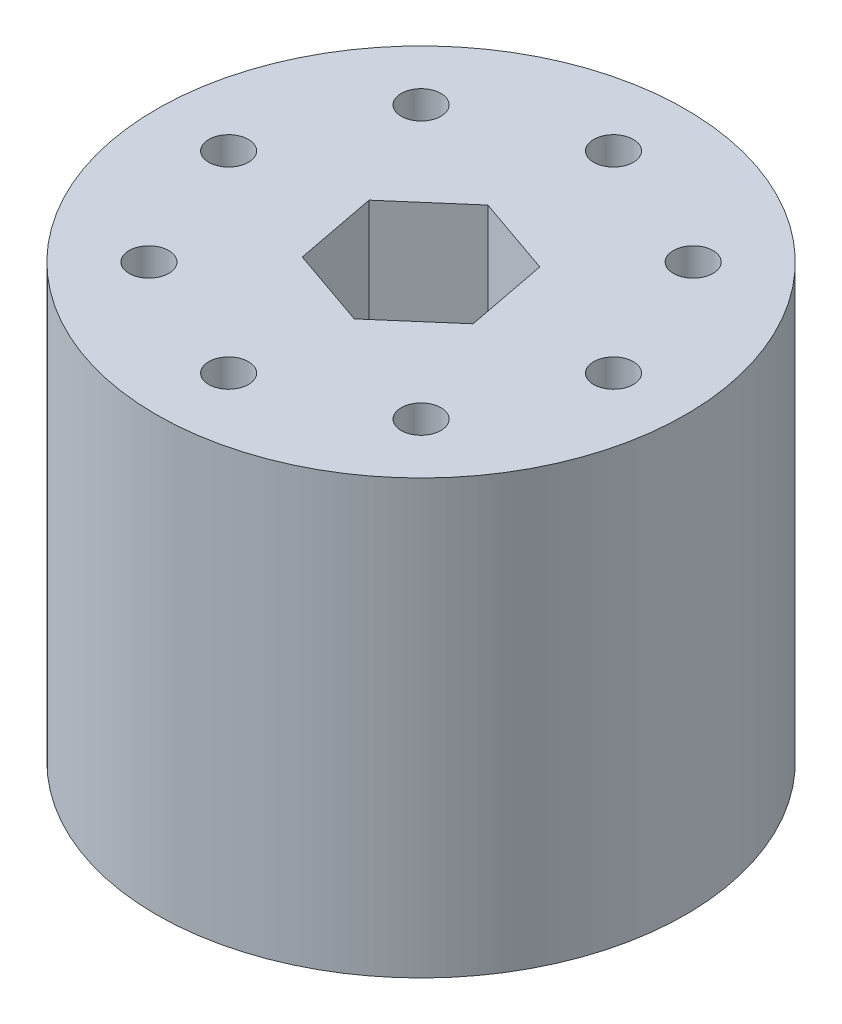
from build123d import *

# Parameters (mm, degrees)
SKETCH1_R           = 22
BOSS_EXTRUDE1_DEPTH = 36
SKETCH2_R           = 1.65
CUT_EXTRUDE1_DEPTH  = 36
CUT_EXTRUDE2_DEPTH  = 10
SKETCH4_R           = 2.3
CUT_EXTRUDE3_DEPTH  = 38
SKETCH5_R           = 5.59540043
CUT_EXTRUDE4_DEPTH  = 9


with BuildPart() as part:
    # Sketch1 → Boss-Extrude1 (new body)
    with BuildSketch(Plane(origin=(0, 0, 0), x_dir=(1, 0, 0), z_dir=(0, 1, 0))):
        with Locations(Location((0, 0, 0), (0, 0, 270))):
            Circle(SKETCH1_R)
    extrude(amount=BOSS_EXTRUDE1_DEPTH)

    # Sketch2 → Cut-Extrude1 (cut)
    with BuildSketch(Plane(origin=(0, 36, 0), x_dir=(1, 0, 0), z_dir=(0, 1, 0))):
        with Locations(Location((-11.313708499, 11.313708499, 0), (0, 0, 270))):
            Circle(SKETCH2_R)
        with Locations(Location((0, 16, 0), (0, 0, 270))):
            Circle(SKETCH2_R)
        with Locations(Location((16, 0, 0), (0, 0, 270))):
            Circle(SKETCH2_R)
        with Locations(Location((11.313708499, 11.313708499, 0), (0, 0, 270))):
            Circle(SKETCH2_R)
        with Locations(Location((0, -16, 0), (0, 0, 270))):
            Circle(SKETCH2_R)
        with Locations(Location((11.313708499, -11.313708499, 0), (0, 0, 270))):
            Circle(SKETCH2_R)
        with Locations(Location((-16, 0, 0), (0, 0, 270))):
            Circle(SKETCH2_R)
        with Locations(Location((-11.313708499, -11.313708499, 0), (0, 0, 270))):
            Circle(SKETCH2_R)
    extrude(amount=-CUT_EXTRUDE1_DEPTH, mode=Mode.SUBTRACT)

    # Sketch3 → Cut-Extrude2 (cut)
    with BuildSketch(Plane(origin=(0, 36, 0), x_dir=(1, 0, 0), z_dir=(0, 1, 0))):
        Polygon((1.321693068, -6.874091026), (6.613983991, -2.29242574), (5.292290922, 4.581665286), (-1.321693068, 6.874091026), (-6.613983991, 2.29242574), (-5.292290922, -4.581665286), align=None)
    extrude(amount=-CUT_EXTRUDE2_DEPTH, mode=Mode.SUBTRACT)

    # Sketch4 → Cut-Extrude3 (cut)
    with BuildSketch(Plane(origin=(0, 26, 0), x_dir=(1, 0, 0), z_dir=(0, 1, 0))):
        with Locations(Location((0, 0, 0), (0, 0, 270))):
            Circle(SKETCH4_R)
    extrude(amount=-CUT_EXTRUDE3_DEPTH, mode=Mode.SUBTRACT)

    # Sketch5 → Cut-Extrude4 (cut)
    with BuildSketch(Plane(origin=(0, 0, 0), x_dir=(-1, 0, 0), z_dir=(0, -1, 0))):
        with Locations(Location((0, 0, 0), (0, 0, 90))):
            Circle(SKETCH5_R)
    extrude(amount=-CUT_EXTRUDE4_DEPTH, mode=Mode.SUBTRACT)


solid = part.part
